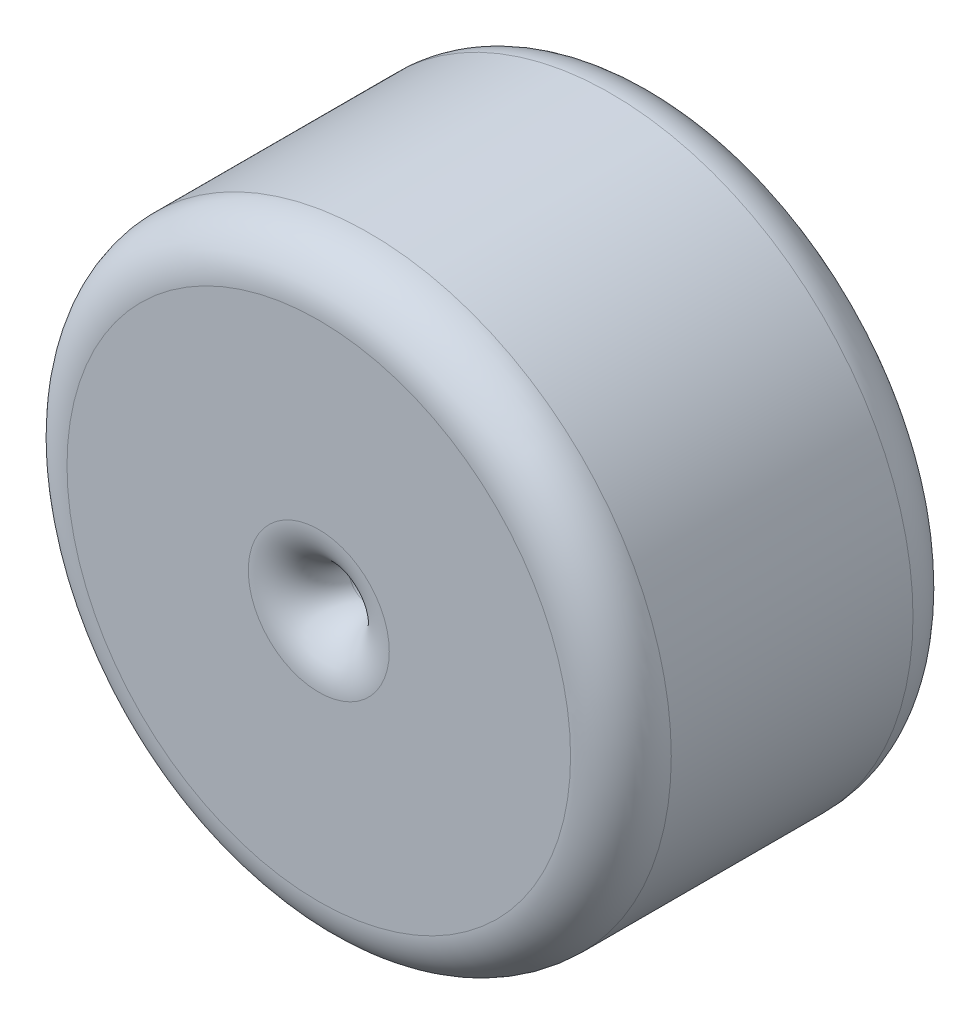
from build123d import *

# Parameters (mm, degrees)
SKETCH1_R           = 15
BOSS_EXTRUDE1_DEPTH = 17
SKETCH2_R           = 1
CUT_EXTRUDE1_DEPTH  = 17
FILLET3_R           = 2.5


with BuildPart() as part:
    # Sketch1 → Boss-Extrude1 (new body)
    with BuildSketch(Plane.XY):
        Circle(SKETCH1_R)
    extrude(amount=BOSS_EXTRUDE1_DEPTH)

    # Sketch2 → Cut-Extrude1 (cut)
    with BuildSketch(Plane(origin=(0, 0, 0), x_dir=(-1, 0, 0), z_dir=(0, 0, -1))):
        Circle(SKETCH2_R)
    extrude(amount=-CUT_EXTRUDE1_DEPTH, mode=Mode.SUBTRACT)

    # Fillet3
    fillet3_edges = [part.edges().sort_by_distance(p)[0] for p in [
        (-15, 0, 0),
        (-15, 0, 17),
        (1, 0, 17),
    ]]
    fillet(fillet3_edges, radius=FILLET3_R)


solid = part.part
